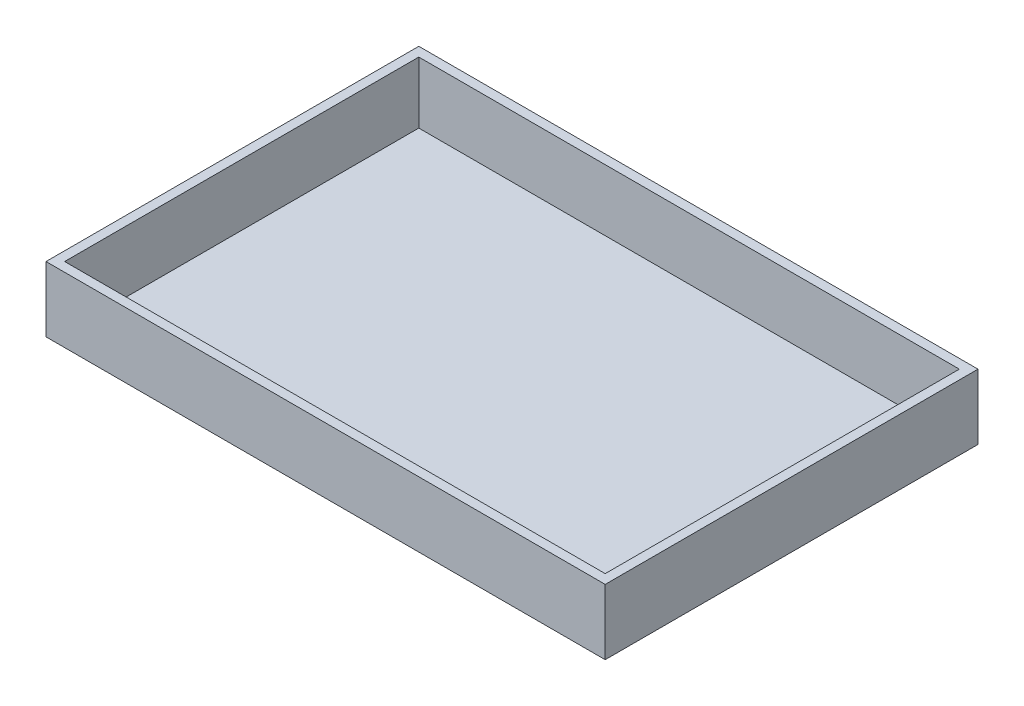
from build123d import *

# Parameters (mm, degrees)
SKETCH1_W           = 30
SKETCH1_H           = 3.5
BOSS_EXTRUDE1_DEPTH = 20
SKETCH2_W           = 29
SKETCH2_H           = 19
CUT_EXTRUDE1_DEPTH  = 3.3


with BuildPart() as part:
    # Sketch1 → Boss-Extrude1 (new body)
    with BuildSketch(Plane.XY):
        Rectangle(SKETCH1_W, SKETCH1_H)
    extrude(amount=BOSS_EXTRUDE1_DEPTH)

    # Sketch2 → Cut-Extrude1 (cut)
    with BuildSketch(Plane(origin=(0, 1.75, 0), x_dir=(1, 0, 0), z_dir=(0, 1, 0))):
        with Locations((0, -10)):
            Rectangle(SKETCH2_W, SKETCH2_H)
    extrude(amount=-CUT_EXTRUDE1_DEPTH, mode=Mode.SUBTRACT)


solid = part.part
